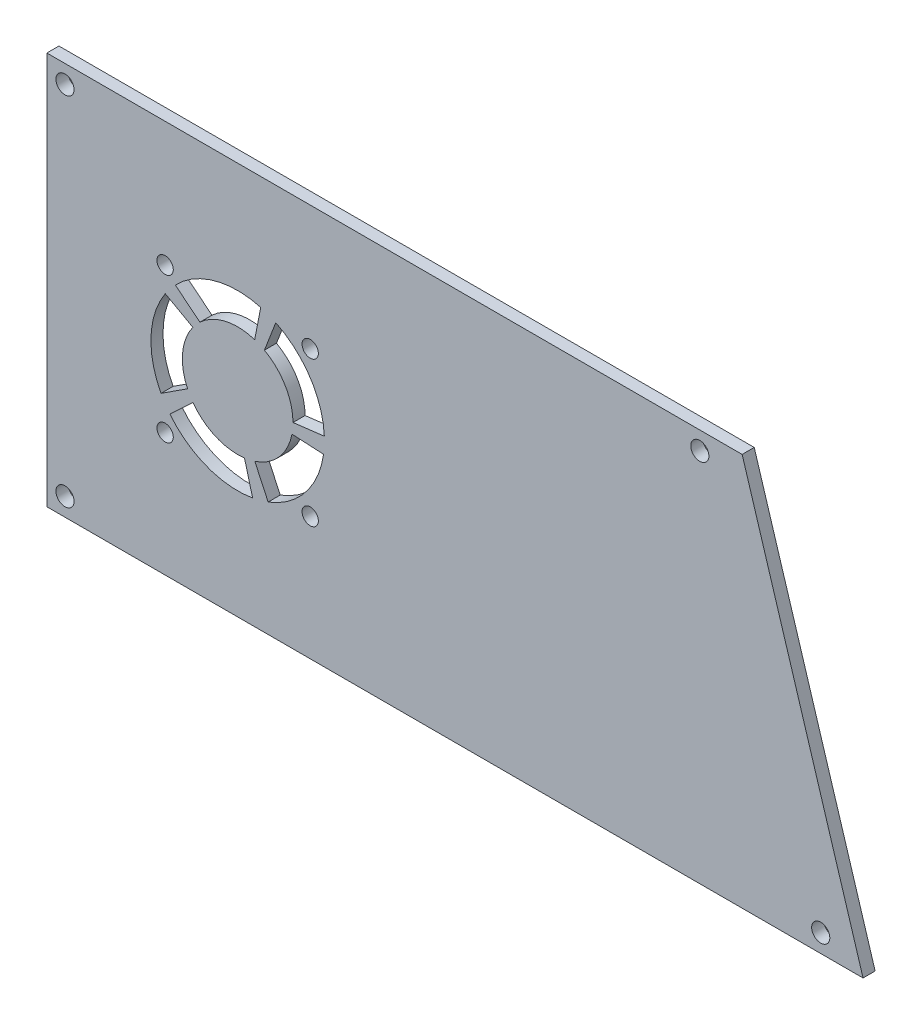
from build123d import *

# Parameters (mm, degrees)
CROQUIS1_W              = 115
CROQUIS1_H              = 65
SALIENTE_EXTRUIR1_DEPTH = 2
SALIENTE_EXTRUIR2_DEPTH = 2
CROQUIS3_R              = 1.5
CORTAR_EXTRUIR1_DEPTH   = 2
CROQUIS4_R              = 1.35
CROQUIS4_R_2            = 14.35
CROQUIS4_R_3            = 9.15
CORTAR_EXTRUIR3_DEPTH   = 2
CROQUIS5_R              = 1.366917162
SALIENTE_EXTRUIR3_DEPTH = 2
MATRIZC1_COUNT          = 5


with BuildPart() as part:
    # Croquis1 → Saliente-Extruir1 (new body)
    with BuildSketch(Plane.XY):
        Rectangle(CROQUIS1_W, CROQUIS1_H)
    extrude(amount=SALIENTE_EXTRUIR1_DEPTH)

    # Croquis2 → Saliente-Extruir2 (add)
    with BuildSketch(Plane(origin=(0, 0, 0), x_dir=(-1, 0, 0), z_dir=(0, 0, -1))):
        Polygon((-57.5, 32.5), (-77.5, -32.5), (-57.5, -32.5), align=None)
    extrude(amount=-SALIENTE_EXTRUIR2_DEPTH)

    # Croquis3 → Cortar-Extruir1 (cut)
    with BuildSketch(Plane(origin=(0, 0, 0), x_dir=(-1, 0, 0), z_dir=(0, 0, -1))):
        with Locations((-50.5, 29.5)):
            Circle(CROQUIS3_R)
        with Locations((-70.5, -29.5)):
            Circle(CROQUIS3_R)
        with Locations((54.5, -29.5)):
            Circle(CROQUIS3_R)
        with Locations((54.5, 29.5)):
            Circle(CROQUIS3_R)
    extrude(amount=-CORTAR_EXTRUIR1_DEPTH, mode=Mode.SUBTRACT)

    # Croquis4 → Cortar-Extruir3 (cut)
    # profile 1 of 5: a face of its own
    with BuildSketch(Plane(origin=(0, 0, 0), x_dir=(-1, 0, 0), z_dir=(0, 0, -1))):
        with Locations((13.94030488, 11.910589373)):
            Circle(CROQUIS4_R)
    # profile 2 of 5: a face of its own
    with BuildSketch(Plane(origin=(0, 0, 0), x_dir=(-1, 0, 0), z_dir=(0, 0, -1))):
        with Locations((37.94030488, 11.910589373)):
            Circle(CROQUIS4_R)
    # profile 3 of 5: a face of its own
    with BuildSketch(Plane(origin=(0, 0, 0), x_dir=(-1, 0, 0), z_dir=(0, 0, -1))):
        with Locations((37.94030488, -12.089410627)):
            Circle(CROQUIS4_R)
    # profile 4 of 5: a face of its own
    with BuildSketch(Plane(origin=(0, 0, 0), x_dir=(-1, 0, 0), z_dir=(0, 0, -1))):
        with Locations((13.94030488, -12.089410627)):
            Circle(CROQUIS4_R)
    # profile 5 of 5: a face of its own
    with BuildSketch(Plane(origin=(0, 0, 0), x_dir=(-1, 0, 0), z_dir=(0, 0, -1))):
        with Locations((25.94030488, -0.089410627)):
            Circle(CROQUIS4_R_2)
        with Locations((25.94030488, -0.089410627)):
            Circle(CROQUIS4_R_3, mode=Mode.SUBTRACT)
    extrude(amount=-CORTAR_EXTRUIR3_DEPTH, mode=Mode.SUBTRACT)


with BuildPart() as cortar_extruir3_piece_1:
    # of the separate pieces the step leaves, piece 1, a body of its own (cortar_extruir3_pieces)
    add(part.part.solids().sort_by_distance((-57.5, -32.5, 0))[0])



with BuildPart() as cortar_extruir3_piece_2:
    # of the separate pieces the step leaves, piece 2, a body of its own (cortar_extruir3_pieces)
    add(part.part.solids().sort_by_distance((-35.09030488, -0.089410627, 2))[0])


with BuildPart() as cortar_extruir3_piece_1_1:
    add(cortar_extruir3_piece_1.part)

    add(cortar_extruir3_piece_2.part)  # Saliente-Extruir3 merges Cortar-Extruir3 piece 2
    # Croquis5 → Saliente-Extruir3 (add)
    with BuildSketch(Plane.XY.offset(2)):
        with Locations((-25.94030488, -0.089410627)):
            Circle(CROQUIS5_R)
        with BuildLine():
            Line((-38.61837968, -6.811681029), (-34.227775342, -3.967597491))
            ThreePointArc((-34.227775342, -3.967597491), (-33.817608325, -4.744578769), (-33.334811119, -5.478638539))
            Line((-33.334811119, -5.478638539), (-37.159332333, -9.036808182))
            ThreePointArc((-37.159332333, -9.036808182), (-37.9405412, -7.958135318), (-38.61837968, -6.811681029))
        make_face()
    saliente_extruir3 = extrude(amount=-SALIENTE_EXTRUIR3_DEPTH)

    # MatrizC1: Saliente-Extruir3 ×5 about axis
    matrizc1_axis = Axis((-25.94030488, -0.089410627, 0), (0, 0, 1))
    for i in range(1, MATRIZC1_COUNT):
        add(saliente_extruir3.rotate(matrizc1_axis, i * 360 / MATRIZC1_COUNT))


solid = cortar_extruir3_piece_1_1.part
